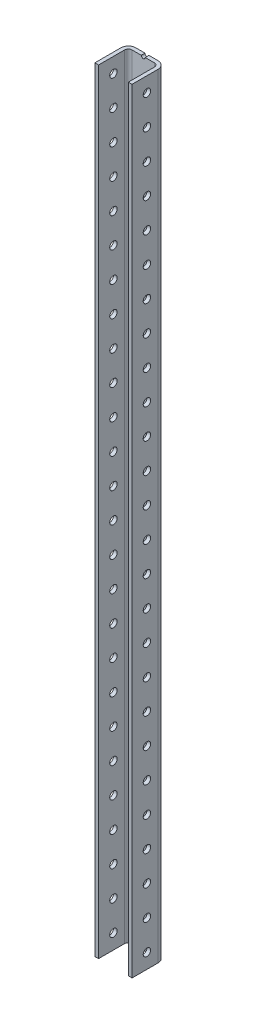
from build123d import *

# Parameters (mm, degrees)
BOSS_EXTRUDE1_DEPTH = 330.2
SKETCH3_R           = 1.651
SKETCH3_R_2         = 4.826
CUT_EXTRUDE1_DEPTH  = 332.814083863
SKETCH4_R           = 3.175
CUT_EXTRUDE2_DEPTH  = 333.951397542
LPATTERN1_COUNT     = 26
LPATTERN1_PITCH     = 25.4


with BuildPart() as part:
    # Sketch2 → Boss-Extrude1 (new, symmetric)
    with BuildSketch(Plane(origin=(0, 0, 0), x_dir=(1, 0, 0), z_dir=(0, 1, 0))):
        with BuildLine():
            Line((-12.7, 0), (-12.7, 22.225))
            ThreePointArc((-12.7, 22.225), (-11.77006403, 24.47006403), (-9.525, 25.4))
            Line((-9.525, 25.4), (9.525, 25.4))
            ThreePointArc((9.525, 25.4), (11.77006403, 24.47006403), (12.7, 22.225))
            Line((12.7, 22.225), (12.7, 0))
            Line((12.7, 0), (15.875, 0))
            Line((15.875, 0), (15.875, 22.225))
            ThreePointArc((15.875, 22.225), (14.015128061, 26.715128061), (9.525, 28.575))
            Line((9.525, 28.575), (-9.525, 28.575))
            ThreePointArc((-9.525, 28.575), (-14.015128061, 26.715128061), (-15.875, 22.225))
            Line((-15.875, 22.225), (-15.875, 0))
            Line((-15.875, 0), (-12.7, 0))
        make_face()
    extrude(amount=BOSS_EXTRUDE1_DEPTH, both=True)

    # Sketch3 → Cut-Extrude1 (cut, through all)
    with BuildSketch(Plane(origin=(0, 0, -28.575), x_dir=(-1, 0, 0), z_dir=(0, 0, -1))):
        with Locations((0, 330.2)):
            Circle(SKETCH3_R)
        with Locations((-2.032, 222.25)):
            Circle(SKETCH3_R_2)
        with Locations((-2.032, 196.85)):
            Circle(SKETCH3_R_2)
        with Locations((-2.032, -6.35)):
            Circle(SKETCH3_R_2)
        with Locations((-2.032, -57.15)):
            Circle(SKETCH3_R_2)
        with Locations((2.032, -114.3)):
            Circle(SKETCH3_R_2)
        with Locations((-2.032, -171.45)):
            Circle(SKETCH3_R_2)
        with Locations((-2.032, -222.25)):
            Circle(SKETCH3_R_2)
    extrude(amount=-CUT_EXTRUDE1_DEPTH, mode=Mode.SUBTRACT)

    # Sketch4 → Cut-Extrude2 (cut, through all)
    with BuildSketch(Plane(origin=(15.875, 0, 0), x_dir=(0, 0, -1), z_dir=(1, 0, 0))):
        with Locations((12.7, 317.5)):
            Circle(SKETCH4_R)
    cut_extrude2 = extrude(amount=-CUT_EXTRUDE2_DEPTH, mode=Mode.SUBTRACT)

    # LPattern1: Cut-Extrude2 ×26
    with Locations(*[(0, -i * LPATTERN1_PITCH, 0) for i in range(1, LPATTERN1_COUNT)]):
        add(cut_extrude2, mode=Mode.SUBTRACT)


solid = part.part
